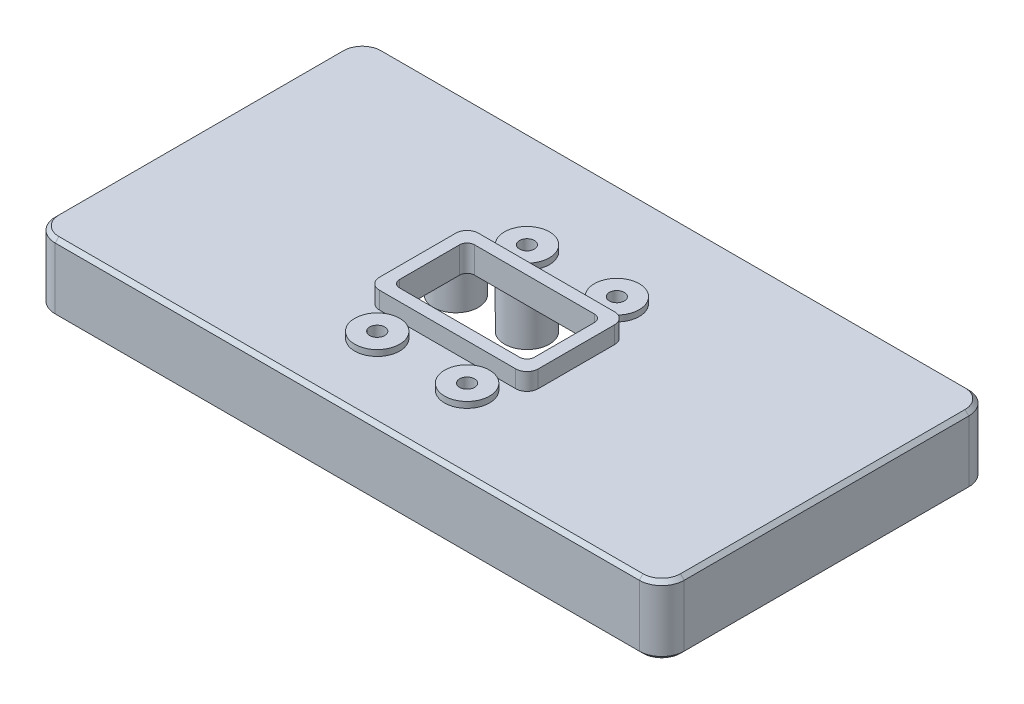
from build123d import *

# Parameters (mm, degrees)
BOSS_EXTRUDE1_START  = 50
BOSS_EXTRUDE1_DEPTH  = 9.2
CHAMFER1_SIZE        = 0.5
CHAMFER2_SIZE        = 0.5
BOSS_EXTRUDE2_START  = 49
BOSS_EXTRUDE2_DEPTH  = 9
BOSS_EXTRUDE3_START  = 50
SKETCH3_R            = 3
BOSS_EXTRUDE3_DEPTH  = 8.01
BOSS_EXTRUDE4_START  = 49
SKETCH4_R            = 1
BOSS_EXTRUDE4_DEPTH  = 9.4
BOSS_EXTRUDE5_START  = 50
SKETCH5_R            = 3
BOSS_EXTRUDE5_DEPTH  = 8.01
BOSS_EXTRUDE6_START  = 49
SKETCH6_R            = 1
BOSS_EXTRUDE6_DEPTH  = 9.4
BOSS_EXTRUDE7_START  = 50
SKETCH7_R            = 3
BOSS_EXTRUDE7_DEPTH  = 8.01
BOSS_EXTRUDE8_START  = 49
SKETCH8_R            = 1
BOSS_EXTRUDE8_DEPTH  = 9.4
BOSS_EXTRUDE9_START  = 50
SKETCH9_R            = 3
BOSS_EXTRUDE9_DEPTH  = 8.01
BOSS_EXTRUDE10_START = 49
SKETCH10_R           = 1
BOSS_EXTRUDE10_DEPTH = 9.4
BOSS_EXTRUDE11_START = 50
SKETCH11_R           = 3
BOSS_EXTRUDE11_DEPTH = 10
BOSS_EXTRUDE12_START = 51.5
SKETCH12_R           = 1
BOSS_EXTRUDE12_DEPTH = 9.5
BOSS_EXTRUDE13_START = 50
SKETCH13_R           = 3
BOSS_EXTRUDE13_DEPTH = 10
BOSS_EXTRUDE14_START = 51.5
SKETCH14_R           = 1
BOSS_EXTRUDE14_DEPTH = 9.5
BOSS_EXTRUDE15_START = 50
SKETCH15_R           = 3
BOSS_EXTRUDE15_DEPTH = 10
BOSS_EXTRUDE16_START = 51.5
SKETCH16_R           = 1
BOSS_EXTRUDE16_DEPTH = 9.5
BOSS_EXTRUDE17_START = 50
SKETCH17_R           = 3
BOSS_EXTRUDE17_DEPTH = 10
BOSS_EXTRUDE18_START = 51.5
SKETCH18_R           = 1
BOSS_EXTRUDE18_DEPTH = 9.5
BOSS_EXTRUDE19_START = 50
BOSS_EXTRUDE19_DEPTH = 1.2
BOSS_EXTRUDE20_START = 57.99
BOSS_EXTRUDE20_DEPTH = 3.51
BOSS_EXTRUDE21_START = 49
BOSS_EXTRUDE21_DEPTH = 13


with BuildPart() as part:
    # Sketch1 → Boss-Extrude1 (new body)
    with BuildSketch(Plane(origin=(0, 0, 0), x_dir=(1, 0, 0), z_dir=(0, 1, 0)).offset(BOSS_EXTRUDE1_START)):
        with BuildLine():
            Line((-39, -36), (39, -36))
            ThreePointArc((39, -36), (41.121320344, -36.878679656), (42, -39))
            Line((42, -39), (42, -77))
            ThreePointArc((42, -77), (41.121320344, -79.121320344), (39, -80))
            Line((39, -80), (-39, -80))
            ThreePointArc((-39, -80), (-41.121320344, -79.121320344), (-42, -77))
            Line((-42, -77), (-42, -39))
            ThreePointArc((-42, -39), (-41.121320344, -36.878679656), (-39, -36))
        make_face()
    extrude(amount=BOSS_EXTRUDE1_DEPTH)

    # Chamfer1
    chamfer1_edges = [part.edges().sort_by_distance(p)[0] for p in [
        (0, 50, 36),
        (-41.121320344, 50, 36.878679656),
        (41.121320344, 50, 36.878679656),
        (-42, 50, 58),
        (42, 50, 58),
        (-41.121320344, 50, 79.121320344),
        (41.121320344, 50, 79.121320344),
        (0, 50, 80),
    ]]
    chamfer(chamfer1_edges, length=CHAMFER1_SIZE)

    # Chamfer2
    chamfer2_edges = [part.edges().sort_by_distance(p)[0] for p in [
        (0, 59.2, 36),
        (-41.121320344, 59.2, 36.878679656),
        (41.121320344, 59.2, 36.878679656),
        (-42, 59.2, 58),
        (42, 59.2, 58),
        (-41.121320344, 59.2, 79.121320344),
        (41.121320344, 59.2, 79.121320344),
        (0, 59.2, 80),
    ]]
    chamfer(chamfer2_edges, length=CHAMFER2_SIZE)


with BuildPart() as body_2:
    # Sketch2 → Boss-Extrude2 (new body)
    with BuildSketch(Plane(origin=(0, 0, 0), x_dir=(1, 0, 0), z_dir=(0, 1, 0)).offset(BOSS_EXTRUDE2_START)):
        with BuildLine():
            Line((-38.6, -38.4), (38.6, -38.4))
            ThreePointArc((38.6, -38.4), (39.307106781, -38.692893219), (39.6, -39.4))
            Line((39.6, -39.4), (39.6, -76.6))
            ThreePointArc((39.6, -76.6), (39.307106781, -77.307106781), (38.6, -77.6))
            Line((38.6, -77.6), (-38.6, -77.6))
            ThreePointArc((-38.6, -77.6), (-39.307106781, -77.307106781), (-39.6, -76.6))
            Line((-39.6, -76.6), (-39.6, -39.4))
            ThreePointArc((-39.6, -39.4), (-39.307106781, -38.692893219), (-38.6, -38.4))
        make_face()
    extrude(amount=BOSS_EXTRUDE2_DEPTH)


with BuildPart() as part_1:
    add(part.part)

    # Combine1: cut body 2
    add(body_2.part, mode=Mode.SUBTRACT)

    # Sketch3 → Boss-Extrude3 (add)
    with BuildSketch(Plane(origin=(0, 0, 0), x_dir=(1, 0, 0), z_dir=(0, 1, 0)).offset(BOSS_EXTRUDE3_START)):
        with Locations((-15, -50.5)):
            Circle(SKETCH3_R)
    extrude(amount=BOSS_EXTRUDE3_DEPTH)


with BuildPart() as body_2_2:
    # Sketch4 → Boss-Extrude4 (new body)
    with BuildSketch(Plane(origin=(0, 0, 0), x_dir=(1, 0, 0), z_dir=(0, 1, 0)).offset(BOSS_EXTRUDE4_START)):
        with Locations((-15, -50.5)):
            Circle(SKETCH4_R)
    extrude(amount=BOSS_EXTRUDE4_DEPTH)


with BuildPart() as part_2:
    add(part_1.part)

    # Combine2: cut body 2 2
    add(body_2_2.part, mode=Mode.SUBTRACT)

    # Sketch5 → Boss-Extrude5 (add)
    with BuildSketch(Plane(origin=(0, 0, 0), x_dir=(1, 0, 0), z_dir=(0, 1, 0)).offset(BOSS_EXTRUDE5_START)):
        with Locations((-15, -69.5)):
            Circle(SKETCH5_R)
    extrude(amount=BOSS_EXTRUDE5_DEPTH)


with BuildPart() as body_2_3:
    # Sketch6 → Boss-Extrude6 (new body)
    with BuildSketch(Plane(origin=(0, 0, 0), x_dir=(1, 0, 0), z_dir=(0, 1, 0)).offset(BOSS_EXTRUDE6_START)):
        with Locations((-15, -69.5)):
            Circle(SKETCH6_R)
    extrude(amount=BOSS_EXTRUDE6_DEPTH)


with BuildPart() as part_3:
    add(part_2.part)

    # Combine3: cut body 2 3
    add(body_2_3.part, mode=Mode.SUBTRACT)

    # Sketch7 → Boss-Extrude7 (add)
    with BuildSketch(Plane(origin=(0, 0, 0), x_dir=(1, 0, 0), z_dir=(0, 1, 0)).offset(BOSS_EXTRUDE7_START)):
        with Locations((15, -50.5)):
            Circle(SKETCH7_R)
    extrude(amount=BOSS_EXTRUDE7_DEPTH)


with BuildPart() as body_2_4:
    # Sketch8 → Boss-Extrude8 (new body)
    with BuildSketch(Plane(origin=(0, 0, 0), x_dir=(1, 0, 0), z_dir=(0, 1, 0)).offset(BOSS_EXTRUDE8_START)):
        with Locations((15, -50.5)):
            Circle(SKETCH8_R)
    extrude(amount=BOSS_EXTRUDE8_DEPTH)


with BuildPart() as part_4:
    add(part_3.part)

    # Combine4: cut body 2 4
    add(body_2_4.part, mode=Mode.SUBTRACT)

    # Sketch9 → Boss-Extrude9 (add)
    with BuildSketch(Plane(origin=(0, 0, 0), x_dir=(1, 0, 0), z_dir=(0, 1, 0)).offset(BOSS_EXTRUDE9_START)):
        with Locations((15, -69.5)):
            Circle(SKETCH9_R)
    extrude(amount=BOSS_EXTRUDE9_DEPTH)


with BuildPart() as body_2_5:
    # Sketch10 → Boss-Extrude10 (new body)
    with BuildSketch(Plane(origin=(0, 0, 0), x_dir=(1, 0, 0), z_dir=(0, 1, 0)).offset(BOSS_EXTRUDE10_START)):
        with Locations((15, -69.5)):
            Circle(SKETCH10_R)
    extrude(amount=BOSS_EXTRUDE10_DEPTH)


with BuildPart() as part_5:
    add(part_4.part)

    # Combine5: cut body 2 5
    add(body_2_5.part, mode=Mode.SUBTRACT)

    # Sketch11 → Boss-Extrude11 (add)
    with BuildSketch(Plane(origin=(0, 0, 0), x_dir=(1, 0, 0), z_dir=(0, 1, 0)).offset(BOSS_EXTRUDE11_START)):
        with Locations((-6, -50)):
            Circle(SKETCH11_R)
    extrude(amount=BOSS_EXTRUDE11_DEPTH)


with BuildPart() as body_2_6:
    # Sketch12 → Boss-Extrude12 (new body)
    with BuildSketch(Plane(origin=(0, 0, 0), x_dir=(1, 0, 0), z_dir=(0, 1, 0)).offset(BOSS_EXTRUDE12_START)):
        with Locations((-6, -50)):
            Circle(SKETCH12_R)
    extrude(amount=BOSS_EXTRUDE12_DEPTH)


with BuildPart() as part_6:
    add(part_5.part)

    # Combine6: cut body 2 6
    add(body_2_6.part, mode=Mode.SUBTRACT)

    # Sketch13 → Boss-Extrude13 (add)
    with BuildSketch(Plane(origin=(0, 0, 0), x_dir=(1, 0, 0), z_dir=(0, 1, 0)).offset(BOSS_EXTRUDE13_START)):
        with Locations((-6, -70)):
            Circle(SKETCH13_R)
    extrude(amount=BOSS_EXTRUDE13_DEPTH)


with BuildPart() as body_2_7:
    # Sketch14 → Boss-Extrude14 (new body)
    with BuildSketch(Plane(origin=(0, 0, 0), x_dir=(1, 0, 0), z_dir=(0, 1, 0)).offset(BOSS_EXTRUDE14_START)):
        with Locations((-6, -70)):
            Circle(SKETCH14_R)
    extrude(amount=BOSS_EXTRUDE14_DEPTH)


with BuildPart() as part_7:
    add(part_6.part)

    # Combine7: cut body 2 7
    add(body_2_7.part, mode=Mode.SUBTRACT)

    # Sketch15 → Boss-Extrude15 (add)
    with BuildSketch(Plane(origin=(0, 0, 0), x_dir=(1, 0, 0), z_dir=(0, 1, 0)).offset(BOSS_EXTRUDE15_START)):
        with Locations((6, -50)):
            Circle(SKETCH15_R)
    extrude(amount=BOSS_EXTRUDE15_DEPTH)


with BuildPart() as body_2_8:
    # Sketch16 → Boss-Extrude16 (new body)
    with BuildSketch(Plane(origin=(0, 0, 0), x_dir=(1, 0, 0), z_dir=(0, 1, 0)).offset(BOSS_EXTRUDE16_START)):
        with Locations((6, -50)):
            Circle(SKETCH16_R)
    extrude(amount=BOSS_EXTRUDE16_DEPTH)


with BuildPart() as part_8:
    add(part_7.part)

    # Combine8: cut body 2 8
    add(body_2_8.part, mode=Mode.SUBTRACT)

    # Sketch17 → Boss-Extrude17 (add)
    with BuildSketch(Plane(origin=(0, 0, 0), x_dir=(1, 0, 0), z_dir=(0, 1, 0)).offset(BOSS_EXTRUDE17_START)):
        with Locations((6, -70)):
            Circle(SKETCH17_R)
    extrude(amount=BOSS_EXTRUDE17_DEPTH)


with BuildPart() as body_2_9:
    # Sketch18 → Boss-Extrude18 (new body)
    with BuildSketch(Plane(origin=(0, 0, 0), x_dir=(1, 0, 0), z_dir=(0, 1, 0)).offset(BOSS_EXTRUDE18_START)):
        with Locations((6, -70)):
            Circle(SKETCH18_R)
    extrude(amount=BOSS_EXTRUDE18_DEPTH)


with BuildPart() as part_9:
    add(part_8.part)

    # Combine9: cut body 2 9
    add(body_2_9.part, mode=Mode.SUBTRACT)

    # Sketch19 → Boss-Extrude19 (add)
    with BuildSketch(Plane(origin=(0, 0, 0), x_dir=(1, 0, 0), z_dir=(0, 1, 0)).offset(BOSS_EXTRUDE19_START)):
        with BuildLine():
            Line((-38.59, -38.39), (38.59, -38.39))
            ThreePointArc((38.59, -38.39), (39.297106781, -38.682893219), (39.59, -39.39))
            Line((39.59, -39.39), (39.59, -76.61))
            ThreePointArc((39.59, -76.61), (39.297106781, -77.317106781), (38.59, -77.61))
            Line((38.59, -77.61), (-38.59, -77.61))
            ThreePointArc((-38.59, -77.61), (-39.297106781, -77.317106781), (-39.59, -76.61))
            Line((-39.59, -76.61), (-39.59, -39.39))
            ThreePointArc((-39.59, -39.39), (-39.297106781, -38.682893219), (-38.59, -38.39))
        make_face()
        with BuildLine():
            Line((-33.6, -39.6), (33.6, -39.6))
            ThreePointArc((33.6, -39.6), (34.307106781, -39.892893219), (34.6, -40.6))
            Line((34.6, -40.6), (34.6, -71.6))
            ThreePointArc((34.6, -71.6), (34.307106781, -72.307106781), (33.6, -72.6))
            Line((33.6, -72.6), (-33.6, -72.6))
            ThreePointArc((-33.6, -72.6), (-34.307106781, -72.307106781), (-34.6, -71.6))
            Line((-34.6, -71.6), (-34.6, -40.6))
            ThreePointArc((-34.6, -40.6), (-34.307106781, -39.892893219), (-33.6, -39.6))
        make_face(mode=Mode.SUBTRACT)
    extrude(amount=BOSS_EXTRUDE19_DEPTH)

    # Sketch20 → Boss-Extrude20 (add)
    with BuildSketch(Plane(origin=(0, 0, 0), x_dir=(1, 0, 0), z_dir=(0, 1, 0)).offset(BOSS_EXTRUDE20_START)):
        with BuildLine():
            Line((-9.1, -53.4), (9.1, -53.4))
            ThreePointArc((9.1, -53.4), (10.160660172, -53.839339828), (10.6, -54.9))
            Line((10.6, -54.9), (10.6, -65.1))
            ThreePointArc((10.6, -65.1), (10.160660172, -66.160660172), (9.1, -66.6))
            Line((9.1, -66.6), (-9.1, -66.6))
            ThreePointArc((-9.1, -66.6), (-10.160660172, -66.160660172), (-10.6, -65.1))
            Line((-10.6, -65.1), (-10.6, -54.9))
            ThreePointArc((-10.6, -54.9), (-10.160660172, -53.839339828), (-9.1, -53.4))
        make_face()
    extrude(amount=BOSS_EXTRUDE20_DEPTH)


with BuildPart() as body_2_10:
    # Sketch21 → Boss-Extrude21 (new body)
    with BuildSketch(Plane(origin=(0, 0, 0), x_dir=(1, 0, 0), z_dir=(0, 1, 0)).offset(BOSS_EXTRUDE21_START)):
        with BuildLine():
            Line((-8, -55), (8, -55))
            ThreePointArc((8, -55), (8.707106781, -55.292893219), (9, -56))
            Line((9, -56), (9, -64))
            ThreePointArc((9, -64), (8.707106781, -64.707106781), (8, -65))
            Line((8, -65), (-8, -65))
            ThreePointArc((-8, -65), (-8.707106781, -64.707106781), (-9, -64))
            Line((-9, -64), (-9, -56))
            ThreePointArc((-9, -56), (-8.707106781, -55.292893219), (-8, -55))
        make_face()
    extrude(amount=BOSS_EXTRUDE21_DEPTH)


with BuildPart() as part_10:
    add(part_9.part)

    # Combine10: cut body 2 10
    add(body_2_10.part, mode=Mode.SUBTRACT)


solid = part_10.part
